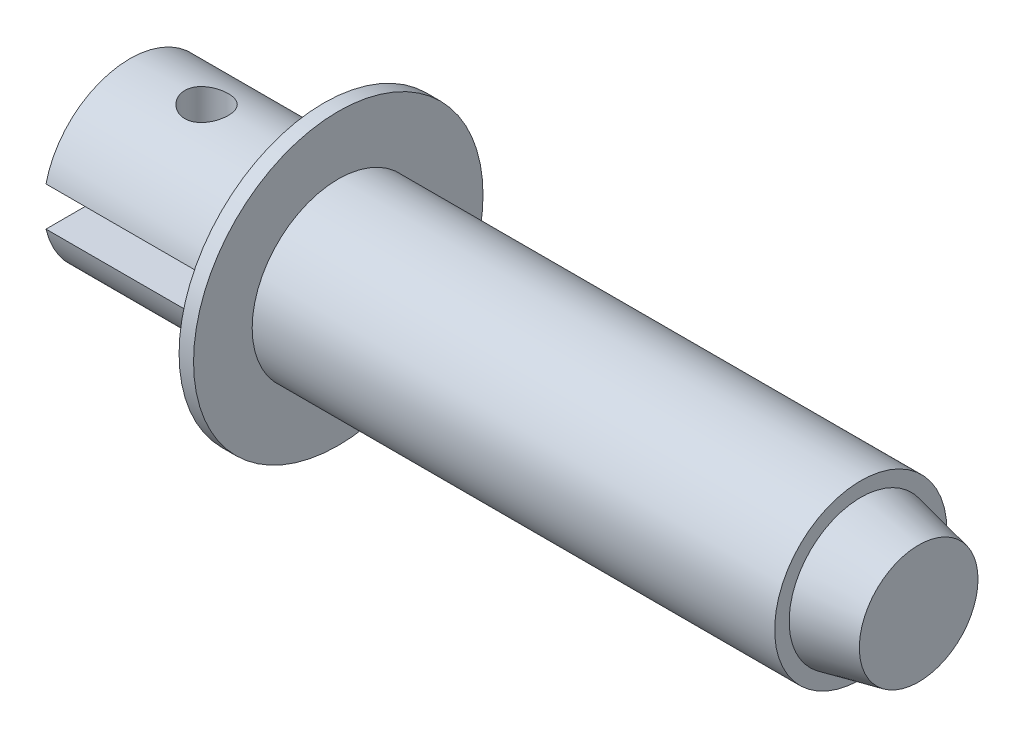
from build123d import *

# Parameters (mm, degrees)
CORTAR_EXTRUIR1_DEPTH      = 10
CORTAR_EXTRUIR1_DEPTH_BACK = 10
CROQUIS2_W                 = 11.9
CROQUIS2_H                 = 2.7
CORTAR_EXTRUIR2_DEPTH      = 10
CORTAR_EXTRUIR2_DEPTH_BACK = 10
CROQUIS3_R                 = 1.5
CROQUIS4_W                 = 1
CROQUIS4_H                 = 10


with BuildPart() as part:
    # Croquis1 → Revolución1 (revolve)
    with BuildSketch(Plane.XY):
        Polygon((-0.440734801, 5.95), (50.059265199, 5.95), (50.059265199, 4.95), (54.059265199, 4.1), (54.059265199, 0), (0, 0), (-0.440734801, 0), align=None)
    revolve(axis=Axis((54.059265199, 0, 0), (-1, 0, 0)))

    # Croquis2 → Cortar-Extruir1 (cut, two sides: drawn at the far end of the back side and taken through both)
    with BuildSketch(Plane.XY.offset(-CORTAR_EXTRUIR1_DEPTH_BACK)):
        with Locations((5.509265199, 0)):
            Rectangle(CROQUIS2_W, CROQUIS2_H)
    extrude(amount=CORTAR_EXTRUIR1_DEPTH + CORTAR_EXTRUIR1_DEPTH_BACK, mode=Mode.SUBTRACT)

    # Croquis3 → Cortar-Extruir2 (cut, two sides: drawn at the far end of the back side and taken through both)
    with BuildSketch(Plane(origin=(0, 0, 0), x_dir=(1, 0, 0), z_dir=(0, 1, 0)).offset(-CORTAR_EXTRUIR2_DEPTH_BACK)):
        with Locations((4.859265199, 0)):
            Circle(CROQUIS3_R)
    extrude(amount=CORTAR_EXTRUIR2_DEPTH + CORTAR_EXTRUIR2_DEPTH_BACK, mode=Mode.SUBTRACT)

    # Croquis4 → Revolución2 (revolve)
    with BuildSketch(Plane(origin=(0, 0, 0), x_dir=(1, 0, 0), z_dir=(0, 1, 0))):
        with Locations((13.459265199, 5)):
            Rectangle(CROQUIS4_W, CROQUIS4_H)
    revolve(axis=Axis((0, 0, 0), (1, 0, 0)))


solid = part.part
